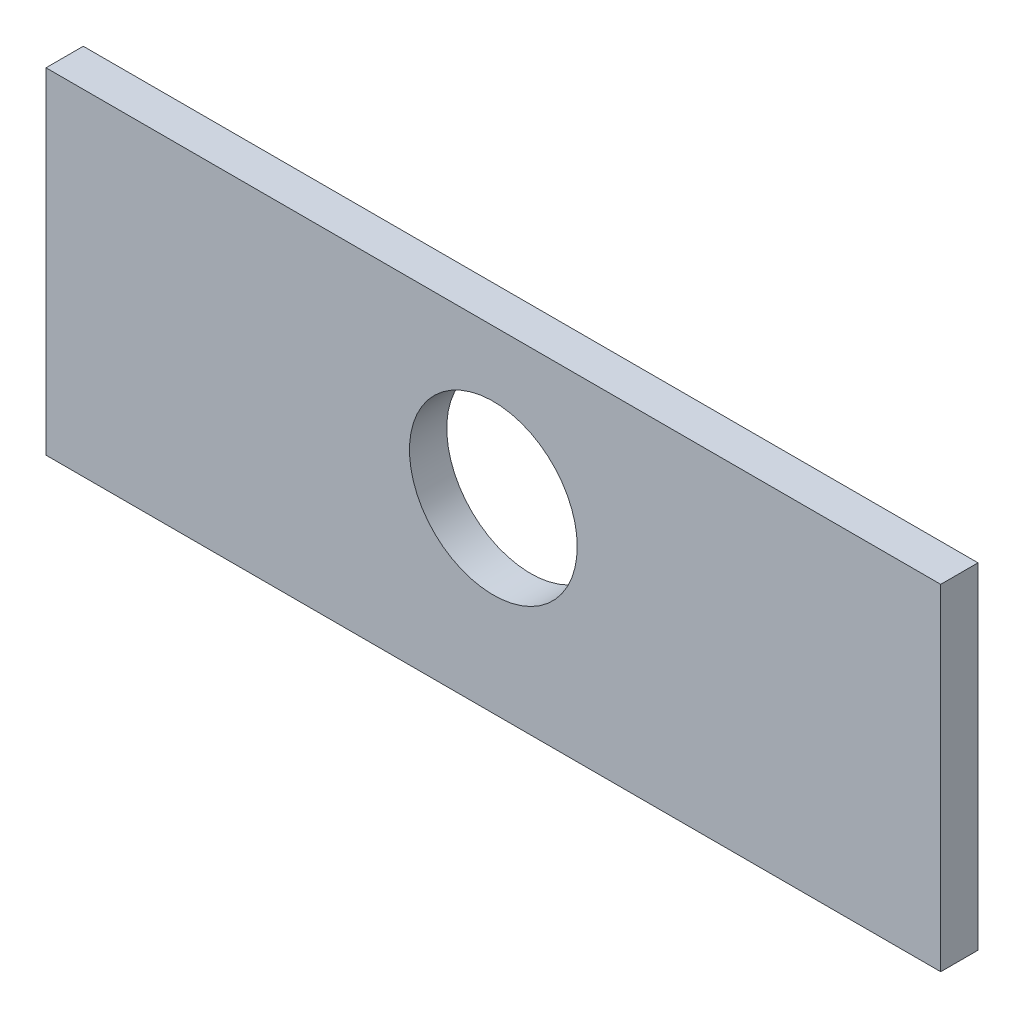
from build123d import *

# Parameters (mm, degrees)
CROQUIS1_W              = 240
CROQUIS1_H              = 90
CROQUIS1_R              = 22.5
SALIENTE_EXTRUIR1_DEPTH = 10


with BuildPart() as part:
    # Croquis1 → Saliente-Extruir1 (new body)
    with BuildSketch(Plane.XY):
        with Locations((120, 45)):
            Rectangle(CROQUIS1_W, CROQUIS1_H)
        with Locations((120, 50)):
            Circle(CROQUIS1_R, mode=Mode.SUBTRACT)
    extrude(amount=SALIENTE_EXTRUIR1_DEPTH)


solid = part.part
